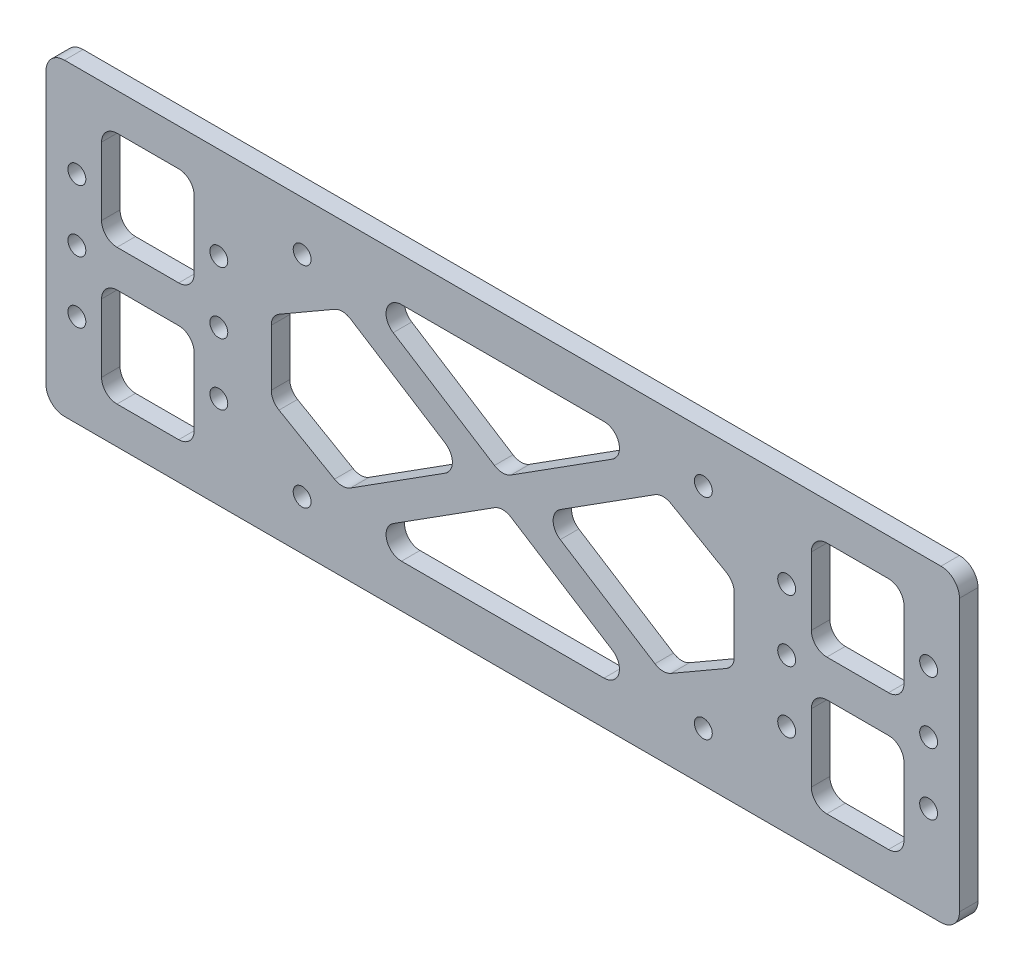
from build123d import *

# Parameters (mm, degrees)
SKETCH_1_W          = 148
SKETCH_1_H          = 50
EXTRUDE_1_DEPTH     = 3
SKETCH_2_R          = 1.45
CUT_EXTRUDE_1_DEPTH = 157.246599963
SKETCH_3_W          = 15
SKETCH_3_H          = 16
CUT_EXTRUDE_2_DEPTH = 10
FILLET_1_R          = 3
FILLET_2_R          = 2.5


with BuildPart() as part:
    # 草图1 → 凸台-拉伸1 (new body)
    with BuildSketch(Plane.XY):
        with Locations((74, 25)):
            Rectangle(SKETCH_1_W, SKETCH_1_H)
    extrude(amount=EXTRUDE_1_DEPTH)

    # 草图2 → 切除-拉伸1 (cut, through all)
    with BuildSketch(Plane.XY.offset(3)):
        with Locations((5, 35)):
            Circle(SKETCH_2_R)
        with Locations((5, 25)):
            Circle(SKETCH_2_R)
        with Locations((5, 15)):
            Circle(SKETCH_2_R)
        with Locations((28, 15)):
            Circle(SKETCH_2_R)
        with Locations((28, 25)):
            Circle(SKETCH_2_R)
        with Locations((28, 35)):
            Circle(SKETCH_2_R)
        with Locations((120, 35)):
            Circle(SKETCH_2_R)
        with Locations((120, 25)):
            Circle(SKETCH_2_R)
        with Locations((120, 15)):
            Circle(SKETCH_2_R)
        with Locations((143, 15)):
            Circle(SKETCH_2_R)
        with Locations((143, 25)):
            Circle(SKETCH_2_R)
        with Locations((143, 35)):
            Circle(SKETCH_2_R)
        with Locations((41.5, 42)):
            Circle(SKETCH_2_R)
        with Locations((106.5, 42)):
            Circle(SKETCH_2_R)
        with Locations((106.5, 8)):
            Circle(SKETCH_2_R)
        with Locations((41.5, 8)):
            Circle(SKETCH_2_R)
    extrude(amount=-CUT_EXTRUDE_1_DEPTH, mode=Mode.SUBTRACT)

    # 草图3 → 切除-拉伸2 (cut)
    with BuildSketch(Plane.XY.offset(3)):
        Polygon((49, 43), (99, 43), (74, 27.111036145), align=None)
        Polygon((48.059067085, 12.326369507), (68, 25), (48.059067085, 37.673630493), (36.5, 31), (36.5, 19), align=None)
        Polygon((99.940932915, 12.326369507), (80, 25), (99.940932915, 37.673630493), (111.5, 31), (111.5, 19), align=None)
        Polygon((74, 22.888963855), (49, 7), (99, 7), align=None)
        with Locations((16.5, 36)):
            Rectangle(SKETCH_3_W, SKETCH_3_H)
        with Locations((16.5, 14)):
            Rectangle(SKETCH_3_W, SKETCH_3_H)
        with Locations((131.5, 36)):
            Rectangle(SKETCH_3_W, SKETCH_3_H)
        with Locations((131.5, 14)):
            Rectangle(SKETCH_3_W, SKETCH_3_H)
    extrude(amount=-CUT_EXTRUDE_2_DEPTH, mode=Mode.SUBTRACT)

    # 圆角1
    fillet_1_edges = [part.edges().sort_by_distance(p)[0] for p in [
        (0, 50, 1.5),
        (148, 50, 1.5),
        (148, 0, 1.5),
        (0, 0, 1.5),
    ]]
    fillet(fillet_1_edges, radius=FILLET_1_R)

    # 圆角2
    fillet_2_edges = [part.edges().sort_by_distance(p)[0] for p in [
        (9, 6, 1.5),
        (9, 22, 1.5),
        (24, 22, 1.5),
        (24, 6, 1.5),
        (74, 22.888963855, 1.5),
        (99, 7, 1.5),
        (49, 7, 1.5),
        (99.940932915, 37.673630493, 1.5),
        (111.5, 31, 1.5),
        (111.5, 19, 1.5),
        (99.940932915, 12.326369507, 1.5),
        (80, 25, 1.5),
        (36.5, 31, 1.5),
        (48.059067085, 37.673630493, 1.5),
        (68, 25, 1.5),
        (48.059067085, 12.326369507, 1.5),
        (36.5, 19, 1.5),
        (124, 28, 1.5),
        (124, 44, 1.5),
        (139, 44, 1.5),
        (139, 28, 1.5),
        (9, 28, 1.5),
        (9, 44, 1.5),
        (24, 44, 1.5),
        (24, 28, 1.5),
        (124, 6, 1.5),
        (124, 22, 1.5),
        (139, 22, 1.5),
        (139, 6, 1.5),
        (74, 27.111036145, 1.5),
        (49, 43, 1.5),
        (99, 43, 1.5),
    ]]
    fillet(fillet_2_edges, radius=FILLET_2_R)


solid = part.part
